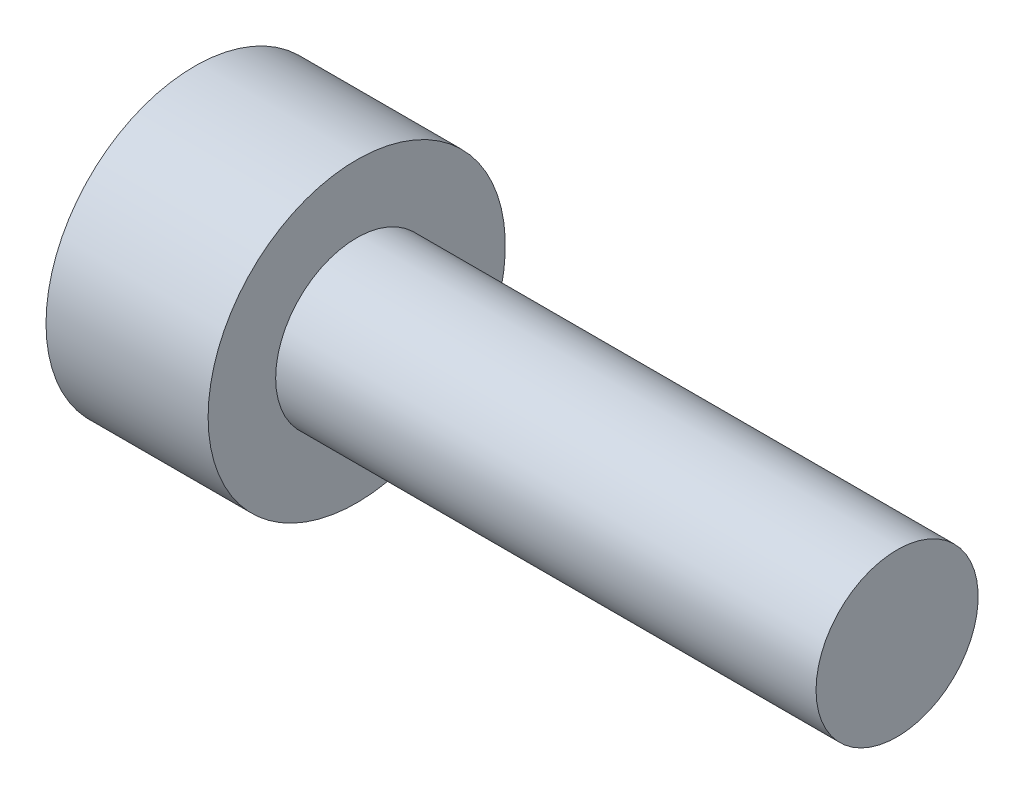
from build123d import *


with BuildPart() as part:
    # Axial profile (mm) → Full revolution (revolve)
    with BuildSketch(Plane.XY, mode=Mode.PRIVATE) as full_revolution_sk:
        Polygon((6.7, 0), (19.7, 0), (19.7, 1.5), (9.7, 1.5), (9.7, 2.75), (6.7, 2.75), align=None)
    revolve(full_revolution_sk.sketch.rotate(Axis((-110, 0, 0), (1, 0, 0)), 90), axis=Axis((-110, 0, 0), (1, 0, 0)))


solid = part.part
